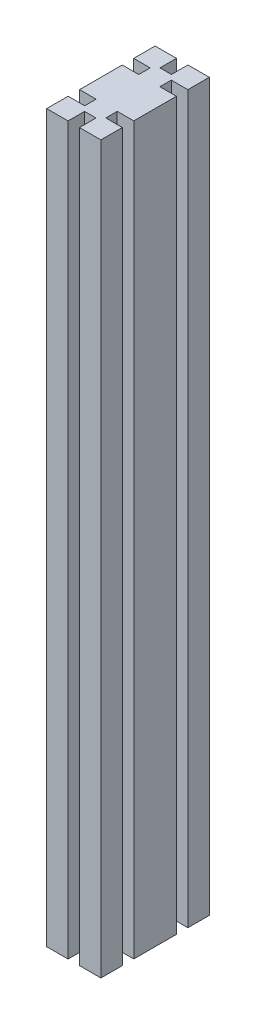
from build123d import *

# Parameters (mm, degrees)
BOSS_EXTRUDE1_DEPTH = 508


with BuildPart() as part:
    # Sketch1 → Boss-Extrude1 (new body)
    with BuildSketch(Plane(origin=(0, 0, 0), x_dir=(1, 0, 0), z_dir=(0, 1, 0))):
        Polygon((-18.95475, -22.9362), (-18.95475, -37.94125), (-4.00685, -37.94125), (-4.00685, -26.38425), (4.00685, -26.38425), (4.00685, -37.94125), (18.95475, -37.94125), (18.95475, -22.9362), (7.39775, -22.9362), (7.39775, -14.9225), (18.95475, -14.9225), (18.95475, 14.9225), (7.39775, 14.9225), (7.39775, 22.9362), (18.95475, 22.9362), (18.95475, 37.94125), (4.00685, 37.94125), (4.00685, 26.38425), (-4.00685, 26.38425), (-4.00685, 37.94125), (-18.95475, 37.94125), (-18.95475, 22.9362), (-7.39775, 22.9362), (-7.39775, 14.9225), (-18.95475, 14.9225), (-18.95475, -14.9225), (-7.39775, -14.9225), (-7.39775, -22.9362), align=None)
    extrude(amount=BOSS_EXTRUDE1_DEPTH)


solid = part.part
